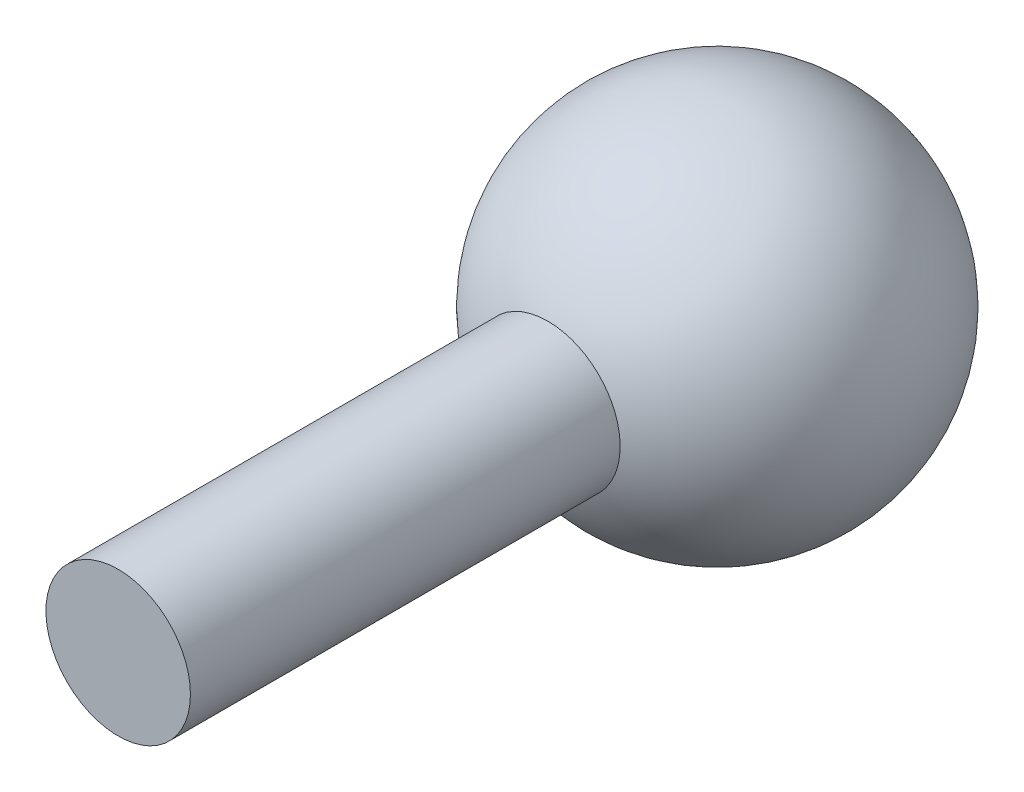
from build123d import *

# Parameters (mm, degrees)
SKETCH1_R           = 20
BOSS_EXTRUDE1_DEPTH = 130
BOSS_EXTRUDE2_DEPTH = 20
SKETCH8_R           = 20
CUT_EXTRUDE1_DEPTH  = 40


with BuildPart() as part:
    # Sketch1 → Boss-Extrude1 (new body)
    with BuildSketch(Plane.XY):
        Circle(SKETCH1_R)
    extrude(amount=BOSS_EXTRUDE1_DEPTH)

    # Sketch2 → Boss-Extrude2 (add, symmetric)
    with BuildSketch(Plane(origin=(0, 0, 0), x_dir=(1, 0, 0), z_dir=(0, 1, 0))):
        with BuildLine():
            ThreePointArc((41.058497276, 35.858056257), (29.032741849, 64.890798106), (0, 76.916553533))
            Line((0, 76.916553533), (0, -5.200441019))
            ThreePointArc((0, -5.200441019), (29.032741849, 6.825314408), (41.058497276, 35.858056257))
        make_face()
    extrude(amount=BOSS_EXTRUDE2_DEPTH, both=True)

    # Sketch8 → Cut-Extrude1 (cut)
    with BuildSketch(Plane(origin=(0, 20, 0), x_dir=(1, 0, 0), z_dir=(0, 1, 0))):
        with Locations((0, 35.858056257)):
            Circle(SKETCH8_R)
    extrude(amount=-CUT_EXTRUDE1_DEPTH, mode=Mode.SUBTRACT)


with BuildPart() as body_2:
    # Sketch2<9> → Revolve5 (revolve)
    with BuildSketch(Plane(origin=(0, 0, 0), x_dir=(1, 0, 0), z_dir=(0, 1, 0))):
        with BuildLine():
            Line((0, 76.916553533), (0, 86.891075769))
            ThreePointArc((0, 86.891075769), (-51.033019512, 35.858056257), (0, -15.174963255))
            Line((0, -15.174963255), (0, -5.200441019))
            ThreePointArc((0, -5.200441019), (-41.058497276, 35.858056257), (0, 76.916553533))
        make_face()
    revolve(axis=Axis((0, 0, -86.891075769), (0, 0, 1)))


solid = Compound([part.part, body_2.part])
